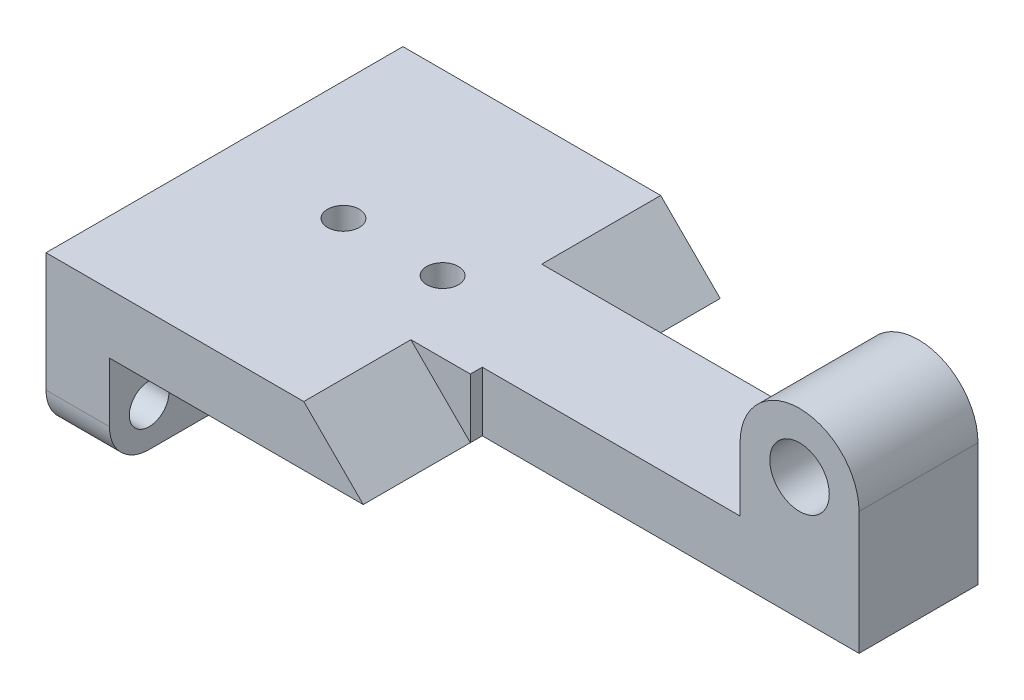
from build123d import *

# Parameters (mm, degrees)
SKETCH1_R                = 7.5
BOSS_EXTRUDE1_DEPTH      = 15
BOSS_EXTRUDE2_DEPTH      = 45
BOSS_EXTRUDE3_DEPTH      = 18
BOSS_EXTRUDE3_DEPTH_BACK = 15
CUT_EXTRUDE1_REACH       = 187.068
SKETCH2_R                = 4
CUT_EXTRUDE2_REACH       = 188.456
SKETCH3_R                = 5


with BuildPart() as part:
    # Sketch1 → Boss-Extrude1 (new, symmetric)
    with BuildSketch(Plane.XY):
        with BuildLine():
            Line((145, 15), (80, 15))
            Line((80, 15), (80, 0))
            Line((80, 0), (175, 0))
            Line((175, 0), (175, 31))
            ThreePointArc((175, 31), (160, 46), (145, 31))
            Line((145, 31), (145, 15))
        make_face()
        with Locations((160, 31)):
            Circle(SKETCH1_R, mode=Mode.SUBTRACT)
    extrude(amount=BOSS_EXTRUDE1_DEPTH, both=True)



with BuildPart() as body_2:
    # Sketch1<3> → Boss-Extrude2 (new, symmetric)
    with BuildSketch(Plane.XY):
        Polygon((65, 15), (0, 15), (0, -25), (16, -25), (16, 0), (80, 0), align=None)
    extrude(amount=BOSS_EXTRUDE2_DEPTH, both=True)


with BuildPart() as part_1:
    add(part.part)

    add(body_2.part)  # Boss-Extrude3 merges body 2
    # Sketch1<4> → Boss-Extrude3 (add, two sides: drawn at the far end of the back side and taken through both)
    with BuildSketch(Plane.XY.offset(-BOSS_EXTRUDE3_DEPTH_BACK)):
        Polygon((80, 15), (65, 15), (80, 0), align=None)
    extrude(amount=BOSS_EXTRUDE3_DEPTH + BOSS_EXTRUDE3_DEPTH_BACK)

    # Sketch2 → Cut-Extrude1 (cut, up to next)
    with BuildSketch(Plane(origin=(0, 15, 0), x_dir=(1, 0, 0), z_dir=(0, 1, 0)), mode=Mode.PRIVATE) as cut_extrude1_sk1:
        with Locations((55, 0)):
            Circle(SKETCH2_R)
    cut_extrude1_tool1 = extrude(cut_extrude1_sk1.sketch, amount=-CUT_EXTRUDE1_REACH, mode=Mode.PRIVATE) & part_1.part
    # Sketch2 → Cut-Extrude1 (cut, up to next)
    with BuildSketch(Plane(origin=(0, 15, 0), x_dir=(1, 0, 0), z_dir=(0, 1, 0)), mode=Mode.PRIVATE) as cut_extrude1_sk2:
        with Locations((30, 0)):
            Circle(SKETCH2_R)
    cut_extrude1_tool2 = extrude(cut_extrude1_sk2.sketch, amount=-CUT_EXTRUDE1_REACH, mode=Mode.PRIVATE) & part_1.part
    add(cut_extrude1_tool1.solids().sort_by_distance((55, 15, 0))[0], mode=Mode.SUBTRACT)
    add(cut_extrude1_tool2.solids().sort_by_distance((30, 15, 0))[0], mode=Mode.SUBTRACT)

    # Sketch3 → Cut-Extrude2 (cut, up to next)
    with BuildSketch(Plane.ZY, mode=Mode.PRIVATE) as cut_extrude2_sk1:
        with Locations((35, -15)):
            Circle(SKETCH3_R)
    cut_extrude2_tool1 = extrude(cut_extrude2_sk1.sketch, amount=-CUT_EXTRUDE2_REACH, mode=Mode.PRIVATE) & part_1.part
    # Sketch3 → Cut-Extrude2 (cut, up to next)
    with BuildSketch(Plane.ZY, mode=Mode.PRIVATE) as cut_extrude2_sk2:
        with BuildLine():
            Line((45, -25), (45, -15))
            ThreePointArc((45, -15), (42.071067812, -22.071067812), (35, -25))
            Line((35, -25), (45, -25))
        make_face()
    cut_extrude2_tool2 = extrude(cut_extrude2_sk2.sketch, amount=-CUT_EXTRUDE2_REACH, mode=Mode.PRIVATE) & part_1.part
    # Sketch3 → Cut-Extrude2 (cut, up to next)
    with BuildSketch(Plane.ZY, mode=Mode.PRIVATE) as cut_extrude2_sk3:
        with BuildLine():
            Line((-45, -25), (-35, -25))
            ThreePointArc((-35, -25), (-42.071067806, -22.071067818), (-45, -15.000000016))
            Line((-45, -15.000000016), (-45, -25))
        make_face()
    cut_extrude2_tool3 = extrude(cut_extrude2_sk3.sketch, amount=-CUT_EXTRUDE2_REACH, mode=Mode.PRIVATE) & part_1.part
    # Sketch3 → Cut-Extrude2 (cut, up to next)
    with BuildSketch(Plane.ZY, mode=Mode.PRIVATE) as cut_extrude2_sk4:
        with Locations((-35, -15)):
            Circle(SKETCH3_R)
    cut_extrude2_tool4 = extrude(cut_extrude2_sk4.sketch, amount=-CUT_EXTRUDE2_REACH, mode=Mode.PRIVATE) & part_1.part
    add(cut_extrude2_tool1.solids().sort_by_distance((0, -15, 35))[0], mode=Mode.SUBTRACT)
    add(cut_extrude2_tool2.solids().sort_by_distance((0, -22.766321, 42.766321))[0], mode=Mode.SUBTRACT)
    add(cut_extrude2_tool3.solids().sort_by_distance((0, -22.766321, -42.766321))[0], mode=Mode.SUBTRACT)
    add(cut_extrude2_tool4.solids().sort_by_distance((0, -15, -35))[0], mode=Mode.SUBTRACT)


solid = part_1.part
